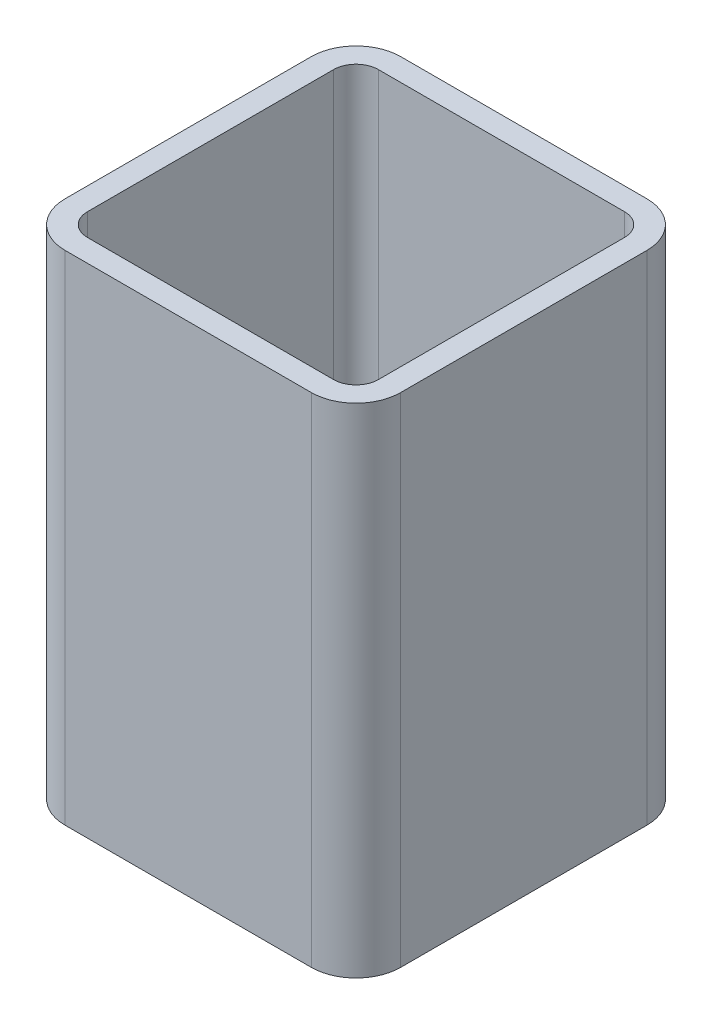
from build123d import *

# Parameters (mm, degrees)
EXTRUDE_1_DEPTH = 44.5


with BuildPart() as part:
    # 草图1 → 凸台-拉伸1 (new body)
    with BuildSketch(Plane(origin=(0, 0, 0), x_dir=(1, 0, 0), z_dir=(0, 1, 0))):
        with BuildLine():
            Line((-11, -15), (11, -15))
            ThreePointArc((11, -15), (13.828427125, -13.828427125), (15, -11))
            Line((15, -11), (15, 11))
            ThreePointArc((15, 11), (13.828427125, 13.828427125), (11, 15))
            Line((11, 15), (-11, 15))
            ThreePointArc((-11, 15), (-13.828427125, 13.828427125), (-15, 11))
            Line((-15, 11), (-15, -11))
            ThreePointArc((-15, -11), (-13.828427125, -13.828427125), (-11, -15))
        make_face()
        with BuildLine():
            Line((-11, -13), (11, -13))
            ThreePointArc((11, -13), (12.414213562, -12.414213562), (13, -11))
            Line((13, -11), (13, 11))
            ThreePointArc((13, 11), (12.414213562, 12.414213562), (11, 13))
            Line((11, 13), (-11, 13))
            ThreePointArc((-11, 13), (-12.414213562, 12.414213562), (-13, 11))
            Line((-13, 11), (-13, -11))
            ThreePointArc((-13, -11), (-12.414213562, -12.414213562), (-11, -13))
        make_face(mode=Mode.SUBTRACT)
    extrude(amount=EXTRUDE_1_DEPTH)


solid = part.part
